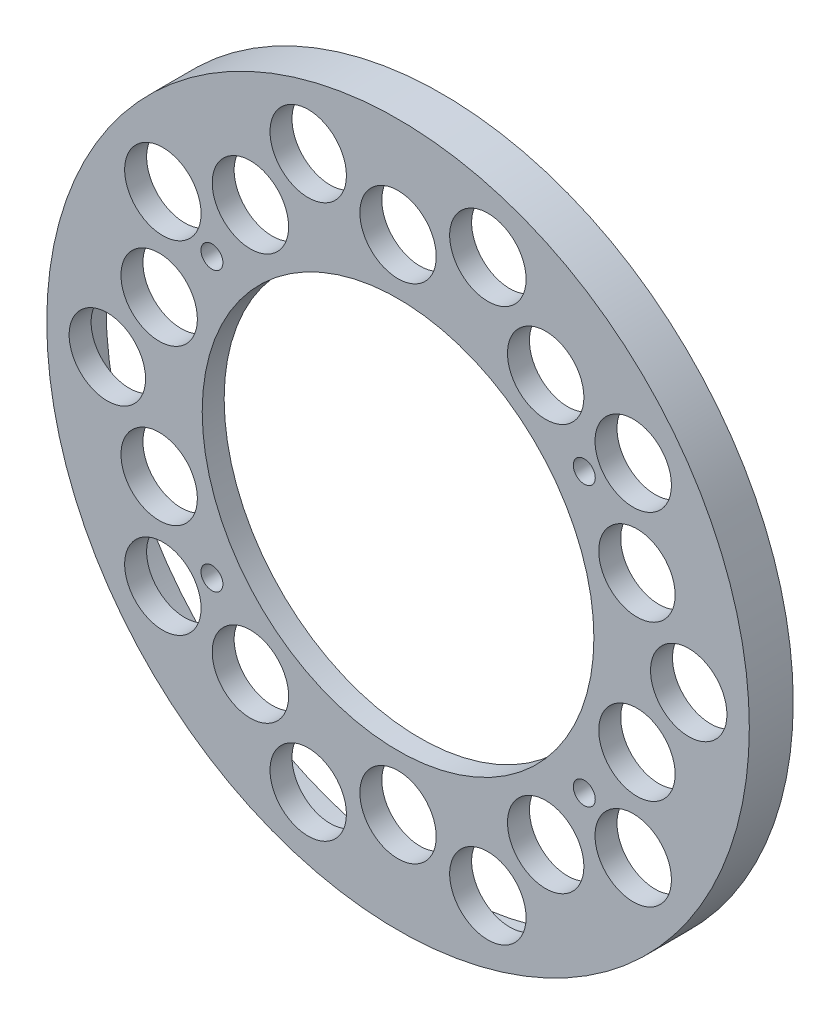
from build123d import *

# Parameters (mm, degrees)
SKETCH1_R           = 101.6
BOSS_EXTRUDE1_DEPTH = 6.35
SKETCH2_R           = 56.642
CUT_EXTRUDE1_DEPTH  = 146.304
SKETCH3_R           = 11.049
CUT_EXTRUDE2_DEPTH  = 146.304
SKETCH4_R           = 11.049
CUT_EXTRUDE3_DEPTH  = 146.304
SKETCH5_R           = 3.175
CUT_EXTRUDE4_DEPTH  = 146.304
BOSS_EXTRUDE2_START = 6.35
SKETCH6_R           = 101.6
SKETCH6_R_2         = 97.155
BOSS_EXTRUDE2_DEPTH = 6.35


with BuildPart() as part:
    # Sketch1 → Boss-Extrude1 (new body)
    with BuildSketch(Plane.XY):
        Circle(SKETCH1_R)
    extrude(amount=BOSS_EXTRUDE1_DEPTH)

    # Sketch2 → Cut-Extrude1 (cut)
    with BuildSketch(Plane.XY.offset(6.35)):
        Circle(SKETCH2_R)
    extrude(amount=-CUT_EXTRUDE1_DEPTH, mode=Mode.SUBTRACT)

    # Sketch3 → Cut-Extrude2 (cut)
    with BuildSketch(Plane.XY.offset(6.35)):
        with Locations((0, 72.644)):
            Circle(SKETCH3_R)
        with Locations((42.699071868, 58.770230539)):
            Circle(SKETCH3_R)
        with Locations((69.08854957, 22.448230539)):
            Circle(SKETCH3_R)
        with Locations((69.08854957, -22.448230539)):
            Circle(SKETCH3_R)
        with Locations((42.699071868, -58.770230539)):
            Circle(SKETCH3_R)
        with Locations((0, -72.644)):
            Circle(SKETCH3_R)
        with Locations((-42.699071868, -58.770230539)):
            Circle(SKETCH3_R)
        with Locations((-69.08854957, -22.448230539)):
            Circle(SKETCH3_R)
        with Locations((-69.08854957, 22.448230539)):
            Circle(SKETCH3_R)
        with Locations((-42.699071868, 58.770230539)):
            Circle(SKETCH3_R)
    extrude(amount=-CUT_EXTRUDE2_DEPTH, mode=Mode.SUBTRACT)

    # Sketch4 → Cut-Extrude3 (cut)
    with BuildSketch(Plane.XY.offset(6.35)):
        with Locations((84.074, 0)):
            Circle(SKETCH4_R)
        with Locations((68.017294785, -49.417457301)):
            Circle(SKETCH4_R)
        with Locations((25.980294785, -79.959125551)):
            Circle(SKETCH4_R)
        with Locations((-25.980294785, -79.959125551)):
            Circle(SKETCH4_R)
        with Locations((-68.017294785, -49.417457301)):
            Circle(SKETCH4_R)
        with Locations((-84.074, 0)):
            Circle(SKETCH4_R)
        with Locations((-68.017294785, 49.417457301)):
            Circle(SKETCH4_R)
        with Locations((-25.980294785, 79.959125551)):
            Circle(SKETCH4_R)
        with Locations((25.980294785, 79.959125551)):
            Circle(SKETCH4_R)
        with Locations((68.017294785, 49.417457301)):
            Circle(SKETCH4_R)
    extrude(amount=-CUT_EXTRUDE3_DEPTH, mode=Mode.SUBTRACT)

    # Sketch5 → Cut-Extrude4 (cut)
    with BuildSketch(Plane.XY.offset(6.35)):
        with Locations((53.867555897, 40.259)):
            Circle(SKETCH5_R)
        with Locations((-53.828444103, 40.259)):
            Circle(SKETCH5_R)
        with Locations((-53.828444103, -40.259)):
            Circle(SKETCH5_R)
        with Locations((53.867555897, -40.259)):
            Circle(SKETCH5_R)
    extrude(amount=-CUT_EXTRUDE4_DEPTH, mode=Mode.SUBTRACT)

    # Sketch6 → Boss-Extrude2 (add)
    with BuildSketch(Plane(origin=(0, 0, 0), x_dir=(-1, 0, 0), z_dir=(0, 0, -1)).offset(BOSS_EXTRUDE2_START)):
        Circle(SKETCH6_R)
        Circle(SKETCH6_R_2, mode=Mode.SUBTRACT)
    extrude(amount=-BOSS_EXTRUDE2_DEPTH)


solid = part.part
